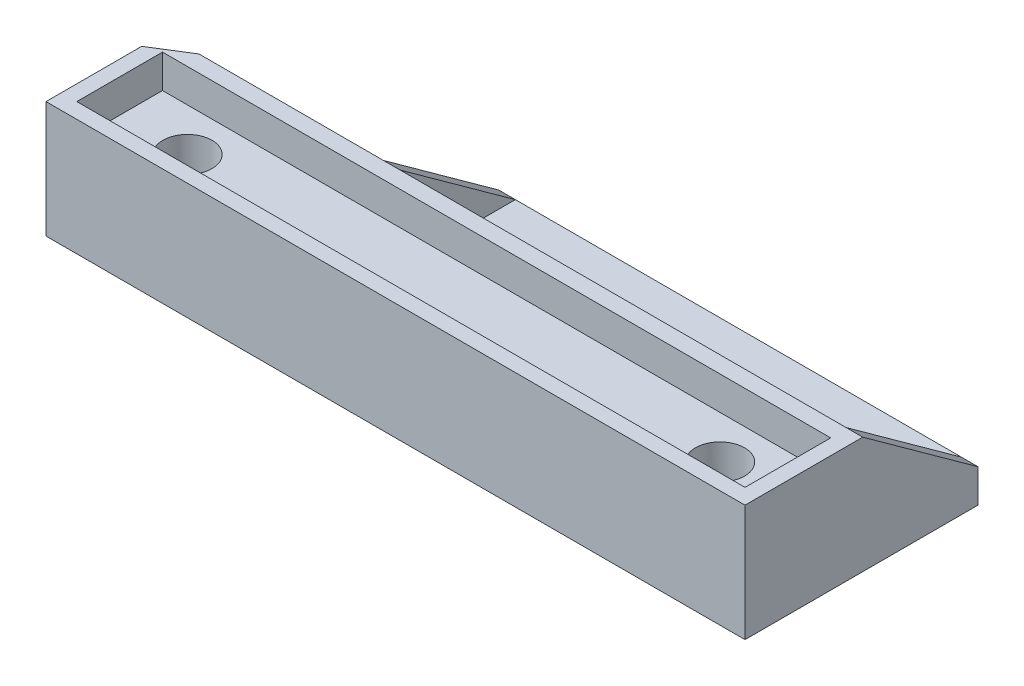
from build123d import *

# Parameters (mm, degrees)
RISER_DEPTH             = 7
SKETCH2_R               = 1.475
MOUNTING_HOLES_DEPTH    = 44.150898021
SKETCH3_W               = 40.15
SKETCH3_H               = 5.15
RECESS_DEPTH            = 2
FLANGE_DEPTH            = 7
SKETCH5_W               = 26.797240136
SKETCH5_H               = 6.925
FLANGE_CUTOUT_DEPTH     = 5
ANGLE_CUTOUT_DEPTH      = 44.886216515
ANGLE_CUTOUT_DEPTH_BACK = 44.886216515
FLANGE_CHAMFER_1_SIZE   = 1
FLANGE_CHAMFER_2_SIZE   = 1


with BuildPart() as part:
    # Sketch1 → Riser (new body)
    with BuildSketch(Plane(origin=(0, 0, 0), x_dir=(1, 0, 0), z_dir=(0, 1, 0))):
        Polygon((2.000418161, 7), (42, 7), (42, 0), (0, 0), (0, 5.75), align=None)
    extrude(amount=RISER_DEPTH)

    # Sketch2 → Mounting Holes (cut, through all)
    with BuildSketch(Plane.XZ):
        with Locations(Location((37, -3.5, 0), (0, 0, 270))):
            Circle(SKETCH2_R)
        with Locations(Location((5, -3.5, 0), (0, 0, 90))):
            Circle(SKETCH2_R)
    extrude(amount=-MOUNTING_HOLES_DEPTH, mode=Mode.SUBTRACT)

    # Sketch3 → Recess (cut)
    with BuildSketch(Plane(origin=(0, 7, 0), x_dir=(1, 0, 0), z_dir=(0, 1, 0))):
        with Locations((21, 3.5)):
            Rectangle(SKETCH3_W, SKETCH3_H)
    extrude(amount=-RECESS_DEPTH, mode=Mode.SUBTRACT)

    # Sketch4 → Flange (add)
    with BuildSketch(Plane(origin=(0, 0, 0), x_dir=(1, 0, 0), z_dir=(0, 1, 0))):
        Polygon((2.000418161, 7), (42, 7), (42, 14), (13.202759864, 14), align=None)
    extrude(amount=FLANGE_DEPTH)

    # Sketch5 → Flange Cutout (cut)
    with BuildSketch(Plane(origin=(0, 7, 0), x_dir=(1, 0, 0), z_dir=(0, 1, 0))):
        with Locations((27.601379932, 10.5375)):
            Rectangle(SKETCH5_W, SKETCH5_H)
        Polygon((2.120443251, 7.075), (13.202759864, 7.075), (13.202759864, 14), align=None)
    extrude(amount=-FLANGE_CUTOUT_DEPTH, mode=Mode.SUBTRACT)

    # Sketch7 → Angle Cutout (cut, two sides: drawn at the far end of the back side and taken through both)
    with BuildSketch(Plane.ZY.offset(-41).offset(-ANGLE_CUTOUT_DEPTH_BACK)):
        Polygon((-7.075, 7), (-14, 2), (-14, 7), align=None)
    extrude(amount=ANGLE_CUTOUT_DEPTH + ANGLE_CUTOUT_DEPTH_BACK, mode=Mode.SUBTRACT)

    # Flange Chamfer 1
    flange_chamfer_1_edges = [part.edges().sort_by_distance(p)[0] for p in [
        (27.601379932, 2, -7.075),
    ]]
    chamfer(flange_chamfer_1_edges, length=FLANGE_CHAMFER_1_SIZE)

    # Flange Chamfer 2
    flange_chamfer_2_edges = [part.edges().sort_by_distance(p)[0] for p in [
        (7.661601558, 2, -7.075),
    ]]
    chamfer(flange_chamfer_2_edges, length=FLANGE_CHAMFER_2_SIZE)


solid = part.part
